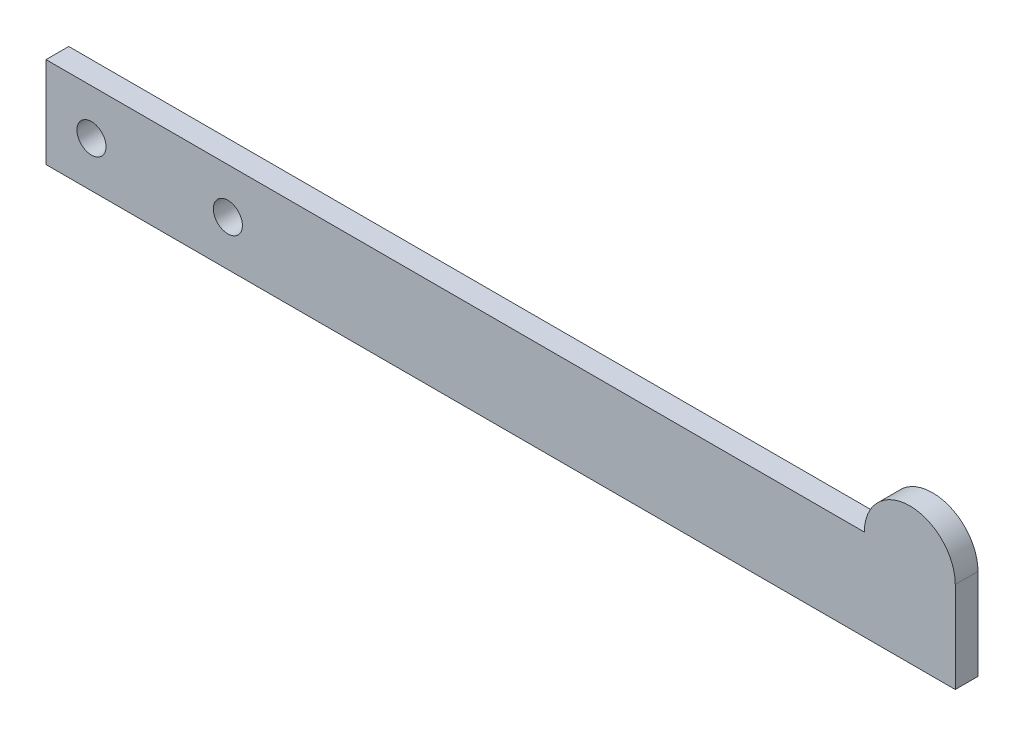
from build123d import *

# Parameters (mm, degrees)
SKETCH1_W           = 127
SKETCH1_H           = 12.7
SKETCH1_R           = 2.032
BOSS_EXTRUDE1_DEPTH = 3.175
BOSS_EXTRUDE2_DEPTH = 3.175


with BuildPart() as part:
    # Sketch1 → Boss-Extrude1 (new body)
    with BuildSketch(Plane.XY):
        Rectangle(SKETCH1_W, SKETCH1_H)
        with Locations((-57.15, 0)):
            Circle(SKETCH1_R, mode=Mode.SUBTRACT)
        with Locations((-38.1, 0)):
            Circle(SKETCH1_R, mode=Mode.SUBTRACT)
    extrude(amount=BOSS_EXTRUDE1_DEPTH)

    # Sketch2 → Boss-Extrude2 (add)
    with BuildSketch(Plane.XY.offset(3.175)):
        with BuildLine():
            Line((63.5, 6.35), (50.8, 6.35))
            ThreePointArc((50.8, 6.35), (57.15, 12.7), (63.5, 6.35))
        make_face()
    extrude(amount=-BOSS_EXTRUDE2_DEPTH)


solid = part.part
